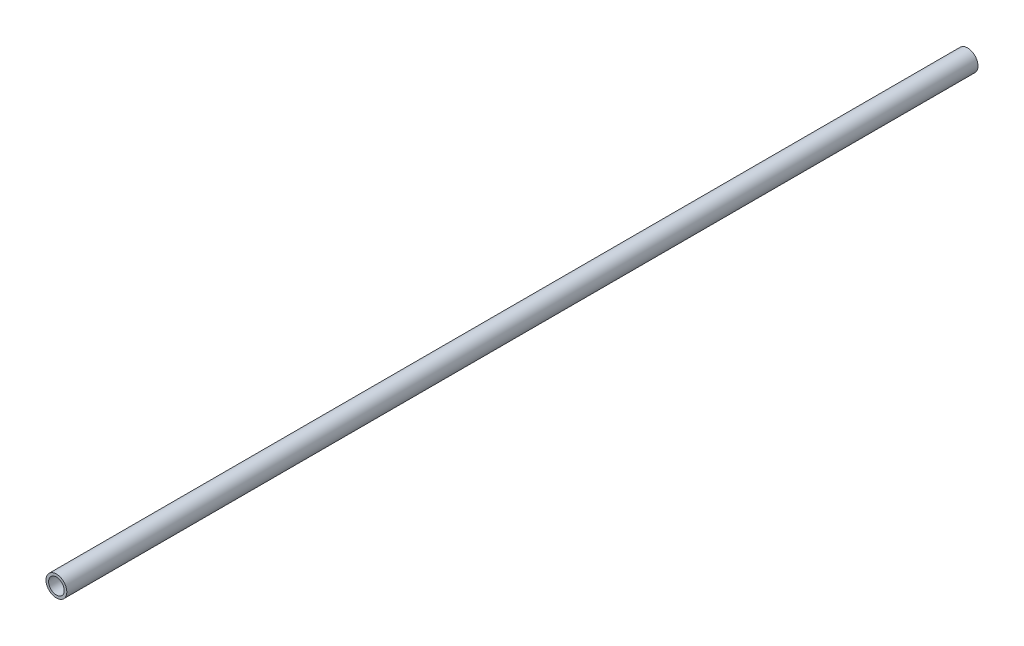
from build123d import *

# Parameters (mm, degrees)
ESQUISSE1_R        = 4
ESQUISSE1_R_2      = 3
EXTRU_MINCE1_DEPTH = 350


with BuildPart() as part:
    # Esquisse1 → Extru.-Mince1 (new body)
    with BuildSketch(Plane.XY):
        Circle(ESQUISSE1_R)
        Circle(ESQUISSE1_R_2, mode=Mode.SUBTRACT)
    extrude(amount=EXTRU_MINCE1_DEPTH)


solid = part.part
